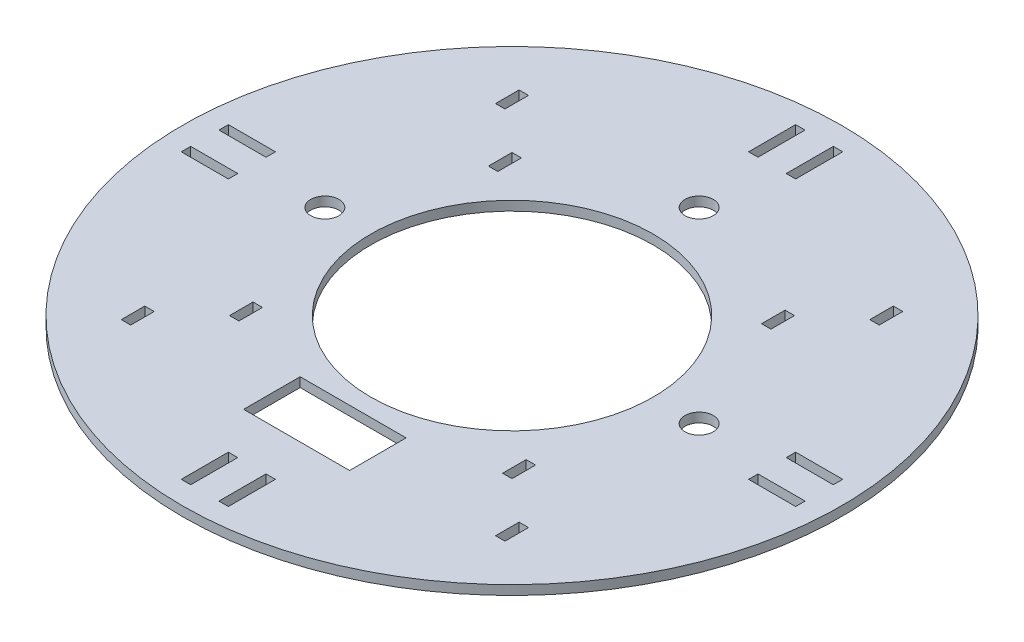
from build123d import *

# Parameters (mm, degrees)
SKETCH1_R                   = 70
SKETCH1_R_2                 = 30
SKETCH1_R_3                 = 3
SKETCH1_W                   = 2
SKETCH1_H                   = 5
SKETCH1_W_2                 = 22.5
SKETCH1_H_2                 = 12
SKETCH1_W_3                 = 5
SKETCH1_H_3                 = 2
Y_KSEKLIK_EKSTR_ZYON1_DEPTH = 2
SKETCH3_W                   = 2
SKETCH3_H                   = 2
SKETCH3_W_2                 = 3
BOSS_EXTRUDE1_DEPTH         = 2
SKETCH5_W                   = 5
SKETCH5_H                   = 2
CUT_EXTRUDE1_DEPTH          = 2
SKETCH6_W                   = 2
SKETCH6_H                   = 2
SKETCH6_W_2                 = 3
BOSS_EXTRUDE3_DEPTH         = 2
SKETCH8_W                   = 5
SKETCH8_H                   = 2
CUT_EXTRUDE2_DEPTH          = 2
SKETCH9_W                   = 2
SKETCH9_H                   = 2
SKETCH9_H_2                 = 3
BOSS_EXTRUDE4_DEPTH         = 2
SKETCH10_W                  = 2
SKETCH10_H                  = 2
SKETCH10_H_2                = 3
BOSS_EXTRUDE5_DEPTH         = 2
SKETCH12_W                  = 2
SKETCH12_H                  = 5
CUT_EXTRUDE4_DEPTH          = 2
SKETCH13_W                  = 2
SKETCH13_H                  = 5
CUT_EXTRUDE5_DEPTH          = 2
SKETCH14_W                  = 3
SKETCH14_H                  = 2
SKETCH14_W_2                = 2
BOSS_EXTRUDE6_DEPTH         = 2
SKETCH15_W                  = 5
SKETCH15_H                  = 2
CUT_EXTRUDE6_DEPTH          = 2
SKETCH16_W                  = 3
SKETCH16_H                  = 2
SKETCH16_W_2                = 2
BOSS_EXTRUDE9_DEPTH         = 2
SKETCH17_W                  = 5
SKETCH17_H                  = 2
CUT_EXTRUDE7_DEPTH          = 2
SKETCH18_W                  = 2
SKETCH18_H                  = 3
SKETCH18_H_2                = 2
BOSS_EXTRUDE10_DEPTH        = 2
SKETCH19_W                  = 2
SKETCH19_H                  = 5
CUT_EXTRUDE8_DEPTH          = 2


with BuildPart() as part:
    # Sketch1 → Yükseklik-Ekstrüzyon1 (new body)
    with BuildSketch(Plane(origin=(0, 0, 0), x_dir=(1, 0, 0), z_dir=(0, 1, 0))):
        with Locations(Location((0, 0, 0), (0, 0, 270))):
            Circle(SKETCH1_R)
        with Locations(Location((0, 0, 0), (0, 0, 270))):
            Circle(SKETCH1_R_2, mode=Mode.SUBTRACT)
        with Locations(Location((39.748737342, 0, 0), (0, 0, 270))):
            Circle(SKETCH1_R_3, mode=Mode.SUBTRACT)
        with Locations(Location((-39.748737342, 0, 0), (0, 0, 270))):
            Circle(SKETCH1_R_3, mode=Mode.SUBTRACT)
        with Locations(Location((0, 39.748737342, 0), (0, 0, 270))):
            Circle(SKETCH1_R_3, mode=Mode.SUBTRACT)
        with Locations((-29, 27.5)):
            Rectangle(SKETCH1_W, SKETCH1_H, mode=Mode.SUBTRACT)
        with Locations((29, 27.5)):
            Rectangle(SKETCH1_W, SKETCH1_H, mode=Mode.SUBTRACT)
        with Locations((-29, -27.5)):
            Rectangle(SKETCH1_W, SKETCH1_H, mode=Mode.SUBTRACT)
        with Locations((29, -27.5)):
            Rectangle(SKETCH1_W, SKETCH1_H, mode=Mode.SUBTRACT)
        with Locations((-39.748737342, 39.748737342)):
            Rectangle(SKETCH1_W, SKETCH1_H, mode=Mode.SUBTRACT)
        with Locations((39.748737342, 39.748737342)):
            Rectangle(SKETCH1_W, SKETCH1_H, mode=Mode.SUBTRACT)
        with Locations((39.748737342, -39.748737342)):
            Rectangle(SKETCH1_W, SKETCH1_H, mode=Mode.SUBTRACT)
        with Locations((-39.748737342, -39.748737342)):
            Rectangle(SKETCH1_W, SKETCH1_H, mode=Mode.SUBTRACT)
        with Locations((0, -39.748737342)):
            Rectangle(SKETCH1_W_2, SKETCH1_H_2, mode=Mode.SUBTRACT)
        with Locations((-64.748737342, 4)):
            Rectangle(SKETCH1_W_3, SKETCH1_H_3, mode=Mode.SUBTRACT)
        with Locations((-64.748737342, -4)):
            Rectangle(SKETCH1_W_3, SKETCH1_H_3, mode=Mode.SUBTRACT)
        with Locations((-54.748737342, -4)):
            Rectangle(SKETCH1_W_3, SKETCH1_H_3, mode=Mode.SUBTRACT)
        with Locations((-54.748737342, 4)):
            Rectangle(SKETCH1_W_3, SKETCH1_H_3, mode=Mode.SUBTRACT)
        with Locations((-4, 64.748737342)):
            Rectangle(SKETCH1_W, SKETCH1_H, mode=Mode.SUBTRACT)
        with Locations((-4, 54.748737342)):
            Rectangle(SKETCH1_W, SKETCH1_H, mode=Mode.SUBTRACT)
        with Locations((4, 54.748737342)):
            Rectangle(SKETCH1_W, SKETCH1_H, mode=Mode.SUBTRACT)
        with Locations((4, 64.748737342)):
            Rectangle(SKETCH1_W, SKETCH1_H, mode=Mode.SUBTRACT)
        with Locations((54.748737342, 4)):
            Rectangle(SKETCH1_W_3, SKETCH1_H_3, mode=Mode.SUBTRACT)
        with Locations((54.748737342, -4)):
            Rectangle(SKETCH1_W_3, SKETCH1_H_3, mode=Mode.SUBTRACT)
        with Locations((64.748737342, 4)):
            Rectangle(SKETCH1_W_3, SKETCH1_H_3, mode=Mode.SUBTRACT)
        with Locations((64.748737342, -4)):
            Rectangle(SKETCH1_W_3, SKETCH1_H_3, mode=Mode.SUBTRACT)
        with Locations((-4, -54.748737342)):
            Rectangle(SKETCH1_W, SKETCH1_H, mode=Mode.SUBTRACT)
        with Locations((4, -54.748737342)):
            Rectangle(SKETCH1_W, SKETCH1_H, mode=Mode.SUBTRACT)
        with Locations((4, -64.748737342)):
            Rectangle(SKETCH1_W, SKETCH1_H, mode=Mode.SUBTRACT)
        with Locations((-4, -64.748737342)):
            Rectangle(SKETCH1_W, SKETCH1_H, mode=Mode.SUBTRACT)
    extrude(amount=Y_KSEKLIK_EKSTR_ZYON1_DEPTH)

    # Sketch3 → Boss-Extrude1 (add)
    with BuildSketch(Plane(origin=(0, 2, 0), x_dir=(1, 0, 0), z_dir=(0, 1, 0))):
        with Locations((-66.248737342, 4)):
            Rectangle(SKETCH3_W, SKETCH3_H)
        with Locations((-53.748737342, 4)):
            Rectangle(SKETCH3_W_2, SKETCH3_H)
    extrude(amount=-BOSS_EXTRUDE1_DEPTH)

    # Sketch5 → Cut-Extrude1 (cut)
    with BuildSketch(Plane(origin=(0, 2, 0), x_dir=(1, 0, 0), z_dir=(0, 1, 0))):
        with Locations((-59.748737342, 4)):
            Rectangle(SKETCH5_W, SKETCH5_H)
    extrude(amount=-CUT_EXTRUDE1_DEPTH, mode=Mode.SUBTRACT)

    # Sketch6 → Boss-Extrude3 (add)
    with BuildSketch(Plane(origin=(0, 2, 0), x_dir=(1, 0, 0), z_dir=(0, 1, 0))):
        with Locations((-66.248737342, -4)):
            Rectangle(SKETCH6_W, SKETCH6_H)
        with Locations((-53.748737342, -4)):
            Rectangle(SKETCH6_W_2, SKETCH6_H)
    extrude(amount=-BOSS_EXTRUDE3_DEPTH)

    # Sketch8 → Cut-Extrude2 (cut)
    with BuildSketch(Plane(origin=(0, 2, 0), x_dir=(1, 0, 0), z_dir=(0, 1, 0))):
        with Locations((-59.748737342, -4)):
            Rectangle(SKETCH8_W, SKETCH8_H)
    extrude(amount=-CUT_EXTRUDE2_DEPTH, mode=Mode.SUBTRACT)

    # Sketch9 → Boss-Extrude4 (add)
    with BuildSketch(Plane(origin=(0, 2, 0), x_dir=(1, 0, 0), z_dir=(0, 1, 0))):
        with Locations((4, 66.248737342)):
            Rectangle(SKETCH9_W, SKETCH9_H)
        with Locations((4, 53.748737342)):
            Rectangle(SKETCH9_W, SKETCH9_H_2)
    extrude(amount=-BOSS_EXTRUDE4_DEPTH)

    # Sketch10 → Boss-Extrude5 (add)
    with BuildSketch(Plane(origin=(0, 2, 0), x_dir=(1, 0, 0), z_dir=(0, 1, 0))):
        with Locations((-4, 66.248737342)):
            Rectangle(SKETCH10_W, SKETCH10_H)
        with Locations((-4, 53.748737342)):
            Rectangle(SKETCH10_W, SKETCH10_H_2)
    extrude(amount=-BOSS_EXTRUDE5_DEPTH)

    # Sketch12 → Cut-Extrude4 (cut)
    with BuildSketch(Plane(origin=(0, 2, 0), x_dir=(1, 0, 0), z_dir=(0, 1, 0))):
        with Locations((-4, 59.748737342)):
            Rectangle(SKETCH12_W, SKETCH12_H)
    extrude(amount=-CUT_EXTRUDE4_DEPTH, mode=Mode.SUBTRACT)

    # Sketch13 → Cut-Extrude5 (cut)
    with BuildSketch(Plane(origin=(0, 2, 0), x_dir=(1, 0, 0), z_dir=(0, 1, 0))):
        with Locations((4, 59.748737342)):
            Rectangle(SKETCH13_W, SKETCH13_H)
    extrude(amount=-CUT_EXTRUDE5_DEPTH, mode=Mode.SUBTRACT)

    # Sketch14 → Boss-Extrude6 (add)
    with BuildSketch(Plane(origin=(0, 2, 0), x_dir=(1, 0, 0), z_dir=(0, 1, 0))):
        with Locations((53.748737342, 4)):
            Rectangle(SKETCH14_W, SKETCH14_H)
        with Locations((66.248737342, 4)):
            Rectangle(SKETCH14_W_2, SKETCH14_H)
    extrude(amount=-BOSS_EXTRUDE6_DEPTH)

    # Sketch15 → Cut-Extrude6 (cut)
    with BuildSketch(Plane(origin=(0, 2, 0), x_dir=(1, 0, 0), z_dir=(0, 1, 0))):
        with Locations((59.748737342, 4)):
            Rectangle(SKETCH15_W, SKETCH15_H)
    extrude(amount=-CUT_EXTRUDE6_DEPTH, mode=Mode.SUBTRACT)

    # Sketch16 → Boss-Extrude9 (add)
    with BuildSketch(Plane(origin=(0, 2, 0), x_dir=(1, 0, 0), z_dir=(0, 1, 0))):
        with Locations((53.748737342, -4)):
            Rectangle(SKETCH16_W, SKETCH16_H)
        with Locations((66.248737342, -4)):
            Rectangle(SKETCH16_W_2, SKETCH16_H)
    extrude(amount=-BOSS_EXTRUDE9_DEPTH)

    # Sketch17 → Cut-Extrude7 (cut)
    with BuildSketch(Plane(origin=(0, 2, 0), x_dir=(1, 0, 0), z_dir=(0, 1, 0))):
        with Locations((59.748737342, -4)):
            Rectangle(SKETCH17_W, SKETCH17_H)
    extrude(amount=-CUT_EXTRUDE7_DEPTH, mode=Mode.SUBTRACT)

    # Sketch18 → Boss-Extrude10 (add)
    with BuildSketch(Plane(origin=(0, 2, 0), x_dir=(1, 0, 0), z_dir=(0, 1, 0))):
        with Locations((-4, -53.748737342)):
            Rectangle(SKETCH18_W, SKETCH18_H)
        with Locations((-4, -66.248737342)):
            Rectangle(SKETCH18_W, SKETCH18_H_2)
        with Locations((4, -66.248737342)):
            Rectangle(SKETCH18_W, SKETCH18_H_2)
        with Locations((4, -53.748737342)):
            Rectangle(SKETCH18_W, SKETCH18_H)
    extrude(amount=-BOSS_EXTRUDE10_DEPTH)

    # Sketch19 → Cut-Extrude8 (cut)
    with BuildSketch(Plane(origin=(0, 2, 0), x_dir=(1, 0, 0), z_dir=(0, 1, 0))):
        with Locations((4, -59.748737342)):
            Rectangle(SKETCH19_W, SKETCH19_H)
        with Locations((-4, -59.748737342)):
            Rectangle(SKETCH19_W, SKETCH19_H)
    extrude(amount=-CUT_EXTRUDE8_DEPTH, mode=Mode.SUBTRACT)


solid = part.part
